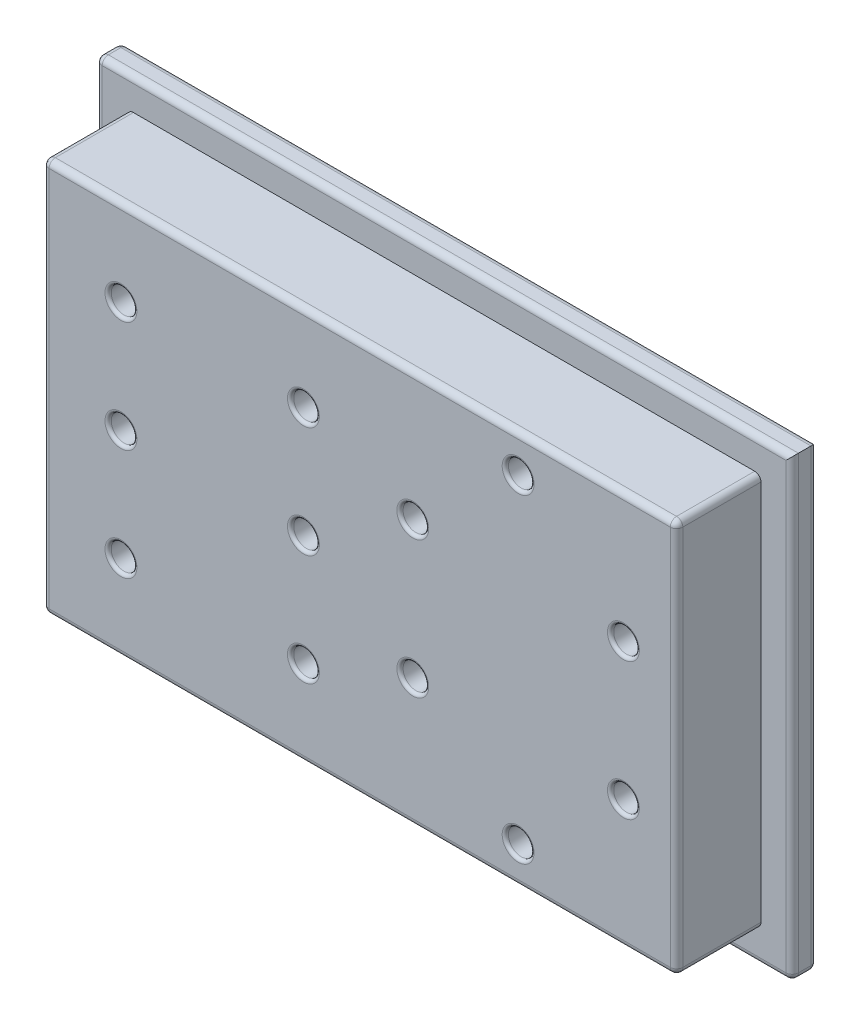
from build123d import *

# Parameters (mm, degrees)
SKETCH_1_W          = 101.4
SKETCH_1_H          = 63
EXTRUDE_1_DEPTH     = 13.5
SKETCH_3_W          = 111.4
SKETCH_3_H          = 73
EXTRUDE_2_DEPTH     = 4
FILLET_1_R          = 1
SKETCH_2_R          = 2.05
CUT_EXTRUDE_1_DEPTH = 69.854847324
FILLET_2_R          = 0.5
SKETCH_4_R          = 4.75
CUT_EXTRUDE_2_DEPTH = 5
FILLET_3_R          = 0.5


with BuildPart() as part:
    # 스케치1 → 보스-돌출1 (new body)
    with BuildSketch(Plane.XY):
        Rectangle(SKETCH_1_W, SKETCH_1_H)
    extrude(amount=EXTRUDE_1_DEPTH)

    # 스케치3 → 보스-돌출2 (add)
    with BuildSketch(Plane(origin=(0, 0, 0), x_dir=(-1, 0, 0), z_dir=(0, 0, -1))):
        Rectangle(SKETCH_3_W, SKETCH_3_H)
    extrude(amount=EXTRUDE_2_DEPTH)

    # 필렛1
    fillet_1_edges = [part.edges().sort_by_distance(p)[0] for p in [
        (50.7, 0, 13.5),
        (0, 31.5, 13.5),
        (55.7, 0, 0),
        (0, -36.5, 0),
        (55.7, -36.5, -2),
        (-55.7, 0, 0),
        (-55.7, -36.5, -2),
        (0, 36.5, 0),
        (-55.7, 36.5, -2),
        (55.7, 0, -4),
        (0, -36.5, -4),
        (-55.7, 0, -4),
        (0, 36.5, -4),
        (-50.7, 0, 13.5),
        (0, -31.5, 13.5),
        (-50.7, 31.5, 6.75),
        (50.7, 31.5, 6.75),
        (50.7, -31.5, 6.75),
        (-50.7, -31.5, 6.75),
    ]]
    fillet(fillet_1_edges, radius=FILLET_1_R)

    # 스케치2 → 컷-돌출1 (cut, through all)
    with BuildSketch(Plane.XY.offset(13.5)):
        with Locations((-38.2, 17.75)):
            Circle(SKETCH_2_R)
        with Locations((-38.2, 0)):
            Circle(SKETCH_2_R)
        with Locations((-38.2, -17.75)):
            Circle(SKETCH_2_R)
        with Locations((-9, 17.75)):
            Circle(SKETCH_2_R)
        with Locations((-9, 0)):
            Circle(SKETCH_2_R)
        with Locations((-9, -17.75)):
            Circle(SKETCH_2_R)
        with Locations((25.35, 25.55)):
            Circle(SKETCH_2_R)
        with Locations((8.5, 10.95)):
            Circle(SKETCH_2_R)
        with Locations((8.5, -10.95)):
            Circle(SKETCH_2_R)
        with Locations((42.2, 10.95)):
            Circle(SKETCH_2_R)
        with Locations((42.2, -10.95)):
            Circle(SKETCH_2_R)
        with Locations((25.35, -25.55)):
            Circle(SKETCH_2_R)
    extrude(amount=-CUT_EXTRUDE_1_DEPTH, mode=Mode.SUBTRACT)

    # 필렛2
    fillet_2_edges = [part.edges().sort_by_distance(p)[0] for p in [
        (-40.25, 0, -4),
        (-40.25, 0, 13.5),
        (-40.25, -17.75, -4),
        (-40.25, -17.75, 13.5),
        (-11.05, 17.75, -4),
        (-11.05, 17.75, 13.5),
        (-11.05, 0, -4),
        (-11.05, 0, 13.5),
        (-11.05, -17.75, -4),
        (-11.05, -17.75, 13.5),
        (23.3, -25.55, -4),
        (23.3, -25.55, 13.5),
        (40.15, -10.95, -4),
        (40.15, -10.95, 13.5),
        (40.15, 10.95, -4),
        (40.15, 10.95, 13.5),
        (6.45, -10.95, -4),
        (6.45, -10.95, 13.5),
        (6.45, 10.95, -4),
        (6.45, 10.95, 13.5),
        (23.3, 25.55, -4),
        (23.3, 25.55, 13.5),
        (-40.25, 17.75, -4),
        (-40.25, 17.75, 13.5),
    ]]
    fillet(fillet_2_edges, radius=FILLET_2_R)

    # 스케치4 → 컷-돌출2 (cut)
    with BuildSketch(Plane(origin=(0, 0, -4), x_dir=(-1, 0, 0), z_dir=(0, 0, -1))):
        with Locations((-43.7, 24.5)):
            Circle(SKETCH_4_R)
        with Locations((-43.7, -24.5)):
            Circle(SKETCH_4_R)
        with Locations((43.7, -24.5)):
            Circle(SKETCH_4_R)
        with Locations((43.7, 24.5)):
            Circle(SKETCH_4_R)
    extrude(amount=-CUT_EXTRUDE_2_DEPTH, mode=Mode.SUBTRACT)

    # 필렛3
    fillet_3_edges = [part.edges().sort_by_distance(p)[0] for p in [
        (48.45, 24.5, -4),
        (48.45, -24.5, -4),
        (-38.95, -24.5, -4),
        (-38.95, 24.5, -4),
    ]]
    fillet(fillet_3_edges, radius=FILLET_3_R)


solid = part.part
